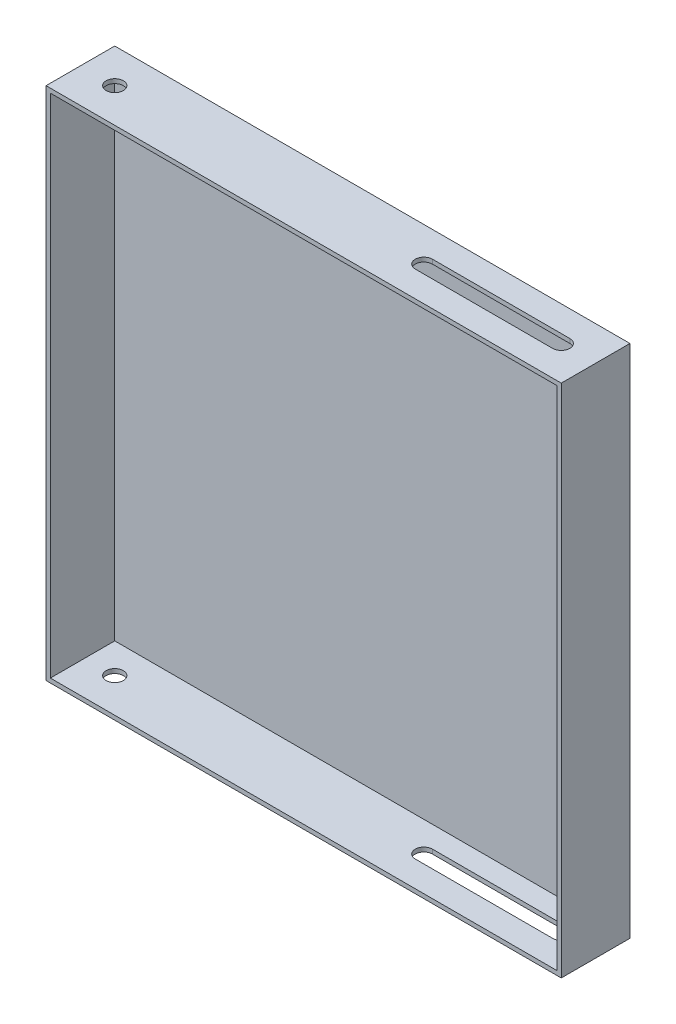
from build123d import *

# Parameters (mm, degrees)
SKETCH1_W           = 381
SKETCH1_H           = 381
BOSS_EXTRUDE1_DEPTH = 50.8
SHELL1_T            = -3.175
SKETCH2_R           = 6.35
CUT_EXTRUDE1_DEPTH  = 417.576
SKETCH4_R           = 6.35
CUT_EXTRUDE2_DEPTH  = 417.576


with BuildPart() as part:
    # Sketch1 → Boss-Extrude1 (new body)
    with BuildSketch(Plane.XY):
        with Locations((190.5, 190.5)):
            Rectangle(SKETCH1_W, SKETCH1_H)
    extrude(amount=BOSS_EXTRUDE1_DEPTH)

    # Shell1
    shell1_openings = [part.faces().sort_by_distance(p)[0] for p in [
        (190.5, 190.5, 50.8),
    ]]
    offset(amount=SHELL1_T, openings=shell1_openings, kind=Kind.INTERSECTION)

    # Sketch2 → Cut-Extrude1 (cut)
    with BuildSketch(Plane(origin=(0, 381, 0), x_dir=(1, 0, 0), z_dir=(0, 1, 0))):
        with Locations(Location((25.4, -25.4, 0), (0, 0, 270))):
            Circle(SKETCH2_R)
    extrude(amount=-CUT_EXTRUDE1_DEPTH, mode=Mode.SUBTRACT)

    # Sketch4 → Cut-Extrude2 (cut)
    with BuildSketch(Plane(origin=(0, 381, 0), x_dir=(1, 0, 0), z_dir=(0, 1, 0))):
        with Locations((254, -25.4)):
            Circle(SKETCH4_R)
        with BuildLine():
            Line((254, -31.75), (355.6, -31.75))
            ThreePointArc((355.6, -31.75), (349.25, -25.4), (355.6, -19.05))
            Line((355.6, -19.05), (254, -19.05))
            ThreePointArc((254, -19.05), (258.490128061, -20.909871939), (260.35, -25.4))
            ThreePointArc((260.35, -25.4), (258.490128061, -29.890128061), (254, -31.75))
        make_face()
        with Locations((355.6, -25.4)):
            Circle(SKETCH4_R)
    extrude(amount=-CUT_EXTRUDE2_DEPTH, mode=Mode.SUBTRACT)


solid = part.part
